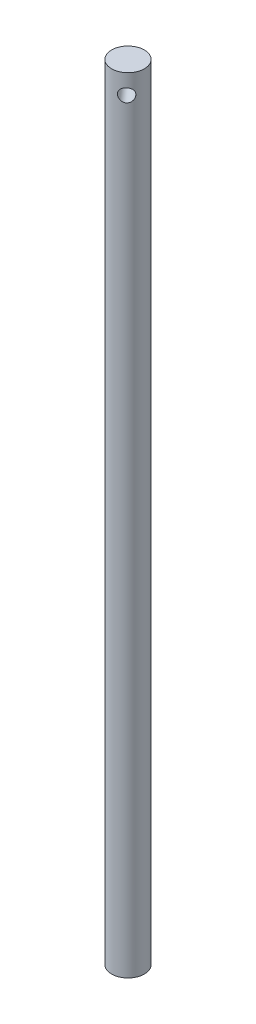
from build123d import *

# Parameters (mm, degrees)
SKETCH1_R           = 12.5
BOSS_EXTRUDE1_DEPTH = 600
SKETCH5_R           = 5
CUT_EXTRUDE2_DEPTH  = 685
CHAMFER1_SIZE       = 2
CHAMFER1_SIZE2      = 1.154700538


with BuildPart() as part:
    # Sketch1 → Boss-Extrude1 (new body)
    with BuildSketch(Plane(origin=(0, 0, 0), x_dir=(1, 0, 0), z_dir=(0, 1, 0))):
        with Locations(Location((0, 0, 0), (0, 0, 270))):
            Circle(SKETCH1_R)
    extrude(amount=BOSS_EXTRUDE1_DEPTH)

    # Sketch5 → Cut-Extrude2 (cut)
    with BuildSketch(Plane(origin=(8.266546367, 600, 9.376257844), x_dir=(0.7501006275419531, 0, -0.6613237093596208), z_dir=(0.6613237093596208, 0, 0.7501006275419531))):
        with Locations((0, -15)):
            Circle(SKETCH5_R)
    extrude(amount=-CUT_EXTRUDE2_DEPTH, mode=Mode.SUBTRACT)

    # Chamfer1
    chamfer1_edges = [part.edges().sort_by_distance(p)[0] for p in [
        (0, 0, -12.5),
    ]]
    chamfer1_side = [part.faces().sort_by_distance(p)[0] for p in [
        (0, 0, 0),
    ]]
    chamfer(chamfer1_edges, length=CHAMFER1_SIZE, length2=CHAMFER1_SIZE2, reference=chamfer1_side[0])


solid = part.part
